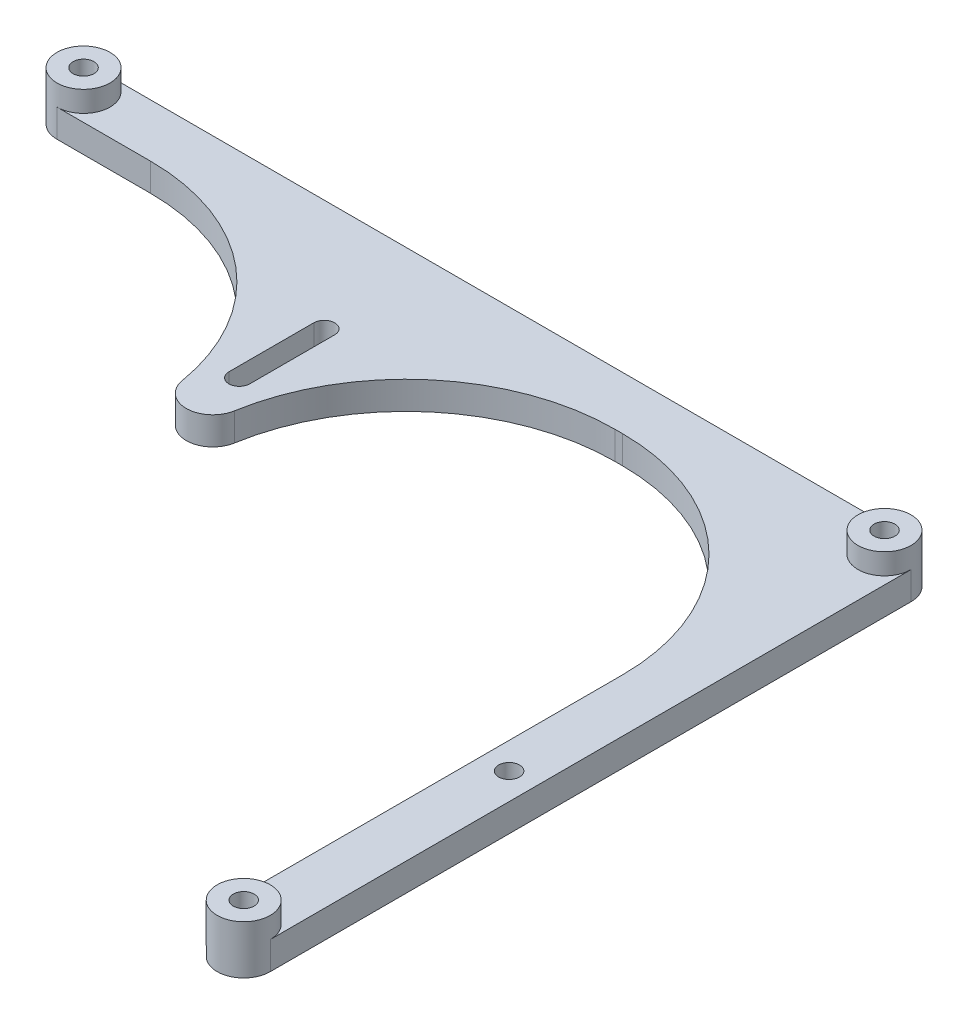
from build123d import *

# Parameters (mm, degrees)
SKETCH1_R           = 1.5
BOSS_EXTRUDE1_DEPTH = 4
SKETCH1_3_R         = 3.81
SKETCH1_3_R_2       = 1.5
BOSS_EXTRUDE2_DEPTH = 7
FILLET1_R           = 30


with BuildPart() as part:
    # Sketch1 → Boss-Extrude1 (new body)
    with BuildSketch(Plane(origin=(0, 0, 0), x_dir=(1, 0, 0), z_dir=(0, 1, 0))):
        with BuildLine():
            ThreePointArc((-3.81, -46), (0, -49.81), (3.81, -46))
            Line((3.81, -46), (3.81, 46))
            ThreePointArc((3.81, 46), (2.694076836, 48.694076836), (0, 49.81))
            Line((0, 49.81), (-115.000000027, 49.81))
            ThreePointArc((-115.000000027, 49.81), (-118.81, 45.999999987), (-115, 42.19))
            Line((-115, 42.19), (-72.06, 42.19))
            Line((-72.06, 42.19), (-72.06, 17.81))
            ThreePointArc((-72.06, 17.81), (-68.25, 14), (-64.44, 17.81))
            Line((-64.44, 17.81), (-64.44, 42.19))
            Line((-64.44, 42.19), (-3.81, 42.19))
            Line((-3.81, 42.19), (-3.81, -46))
        make_face()
        with Locations((0, -46)):
            Circle(SKETCH1_R, mode=Mode.SUBTRACT)
        with Locations((0, -7.9)):
            Circle(SKETCH1_R, mode=Mode.SUBTRACT)
        with Locations((0, 46)):
            Circle(SKETCH1_R, mode=Mode.SUBTRACT)
        with BuildLine():
            Line((-66.75, 33.81), (-66.75, 21.62))
            ThreePointArc((-66.75, 21.62), (-68.25, 20.12), (-69.75, 21.62))
            Line((-69.75, 21.62), (-69.75, 33.81))
            ThreePointArc((-69.75, 33.81), (-68.25, 35.31), (-66.75, 33.81))
        make_face(mode=Mode.SUBTRACT)
        with Locations((-115, 46)):
            Circle(SKETCH1_R, mode=Mode.SUBTRACT)
    extrude(amount=BOSS_EXTRUDE1_DEPTH)

    # Sketch1<3> → Boss-Extrude2 (add)
    # profile 1 of 3: a face of its own
    with BuildSketch(Plane(origin=(0, 0, 0), x_dir=(1, 0, 0), z_dir=(0, 1, 0))):
        with Locations((0, -46)):
            Circle(SKETCH1_3_R)
        with Locations((0, -46)):
            Circle(SKETCH1_3_R_2, mode=Mode.SUBTRACT)
    # profile 2 of 3: a face of its own
    with BuildSketch(Plane(origin=(0, 0, 0), x_dir=(1, 0, 0), z_dir=(0, 1, 0))):
        with Locations((0, 46)):
            Circle(SKETCH1_3_R)
        with Locations((0, 46)):
            Circle(SKETCH1_3_R_2, mode=Mode.SUBTRACT)
    # profile 3 of 3: a face of its own
    with BuildSketch(Plane(origin=(0, 0, 0), x_dir=(1, 0, 0), z_dir=(0, 1, 0))):
        with Locations((-115, 46)):
            Circle(SKETCH1_3_R)
        with Locations((-115, 46)):
            Circle(SKETCH1_3_R_2, mode=Mode.SUBTRACT)
    extrude(amount=BOSS_EXTRUDE2_DEPTH)

    # Fillet1
    fillet1_edges = [part.edges().sort_by_distance(p)[0] for p in [
        (-64.44, 2, -42.19),
        (-72.06, 2, -42.19),
        (-3.81, 2, -42.19),
    ]]
    fillet(fillet1_edges, radius=FILLET1_R)


solid = part.part
